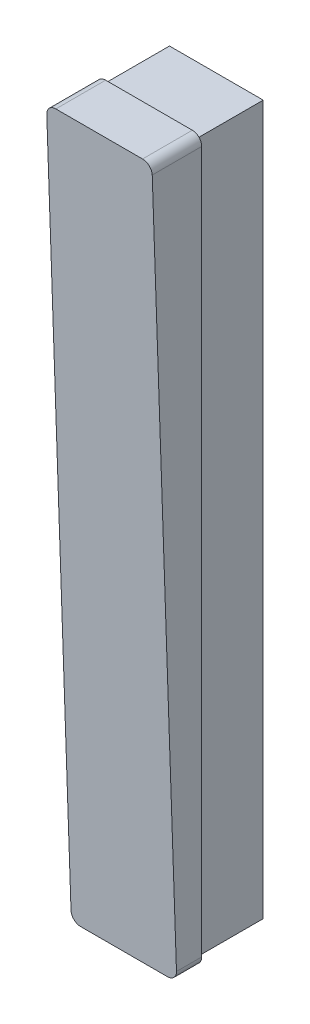
from build123d import *

# Parameters (mm, degrees)
BOSS_EXTRUDE1_DEPTH               = 57.15
SKETCH15_W                        = 50.8
SKETCH15_H                        = 384.175
BOSS_EXTRUDE7_DEPTH               = 36.5125
M8_CLEARANCE_HOLE1_D              = 8.4328
M8_CLEARANCE_HOLE1_DEPTH          = 24.3586
M8_CLEARANCE_HOLE1_TIP            = 2.533468714
FILLET1_R                         = 5.08
F_3_4_NPT_TAPPED_HOLE1_AT_2_COUNT = 2
F_3_4_NPT_TAPPED_HOLE1_AT_2_PITCH = 311.15


with BuildPart() as part:
    # Sketch1 → Boss-Extrude1 (new body)
    with BuildSketch(Plane(origin=(-28.575, 0, 0), x_dir=(0, -1, 0), z_dir=(-1, 0, 0))):
        Polygon((195.2625, 13.49375), (-195.2625, 26.9875), (-195.2625, 0), (195.2625, 0), align=None)
    extrude(amount=-BOSS_EXTRUDE1_DEPTH)

    # Sketch15 → Boss-Extrude7 (add)
    with BuildSketch(Plane(origin=(0, 0, 0), x_dir=(-1, 0, 0), z_dir=(0, 0, -1))):
        Rectangle(SKETCH15_W, SKETCH15_H)
    extrude(amount=BOSS_EXTRUDE7_DEPTH)

    # M8 Clearance Hole1
    with Locations(Plane(origin=(0, 0, -36.5125), x_dir=(-1, 0, 0), z_dir=(0, 0, -1))):
        with Locations((0, 100.0125), (0, -122.2375)):
            Hole(M8_CLEARANCE_HOLE1_D / 2, depth=M8_CLEARANCE_HOLE1_DEPTH)
            with Locations((0, 0, -(M8_CLEARANCE_HOLE1_DEPTH + M8_CLEARANCE_HOLE1_TIP / 2))):  # 118° drill point
                Cone(0, M8_CLEARANCE_HOLE1_D / 2, M8_CLEARANCE_HOLE1_TIP, mode=Mode.SUBTRACT)

    # Fillet1
    fillet1_edges = [part.edges().sort_by_distance(p)[0] for p in [
        (28.575, 195.2625, 13.49375),
        (28.575, -195.2625, 6.746875),
        (-28.575, 195.2625, 13.49375),
        (-28.575, -195.2625, 6.746875),
    ]]
    fillet(fillet1_edges, radius=FILLET1_R)

    # Sketch27 → 3/4 NPT Tapped Hole1 (revolve, cut)
    with BuildSketch(Plane(origin=(0, 144.4625, -36.5125), x_dir=(0, 1, 0), z_dir=(1, 0, 0))):
        Polygon((0, 0), (0, 30.027622455), (11.5062, 23.114), (11.5062, 14.0462), (12.914209362, 14.0462), (13.3347714, 0), align=None)
    f_3_4_npt_tapped_hole1 = revolve(axis=Axis((0, 144.4625, -42.8625), (0, 0, 1)), mode=Mode.SUBTRACT)

    # 3/4 NPT Tapped Hole1 at 2: 3/4 NPT Tapped Hole1 ×2
    with Locations(*[(0, -i * F_3_4_NPT_TAPPED_HOLE1_AT_2_PITCH, 0) for i in range(1, F_3_4_NPT_TAPPED_HOLE1_AT_2_COUNT)]):
        add(f_3_4_npt_tapped_hole1, mode=Mode.SUBTRACT)


solid = part.part
